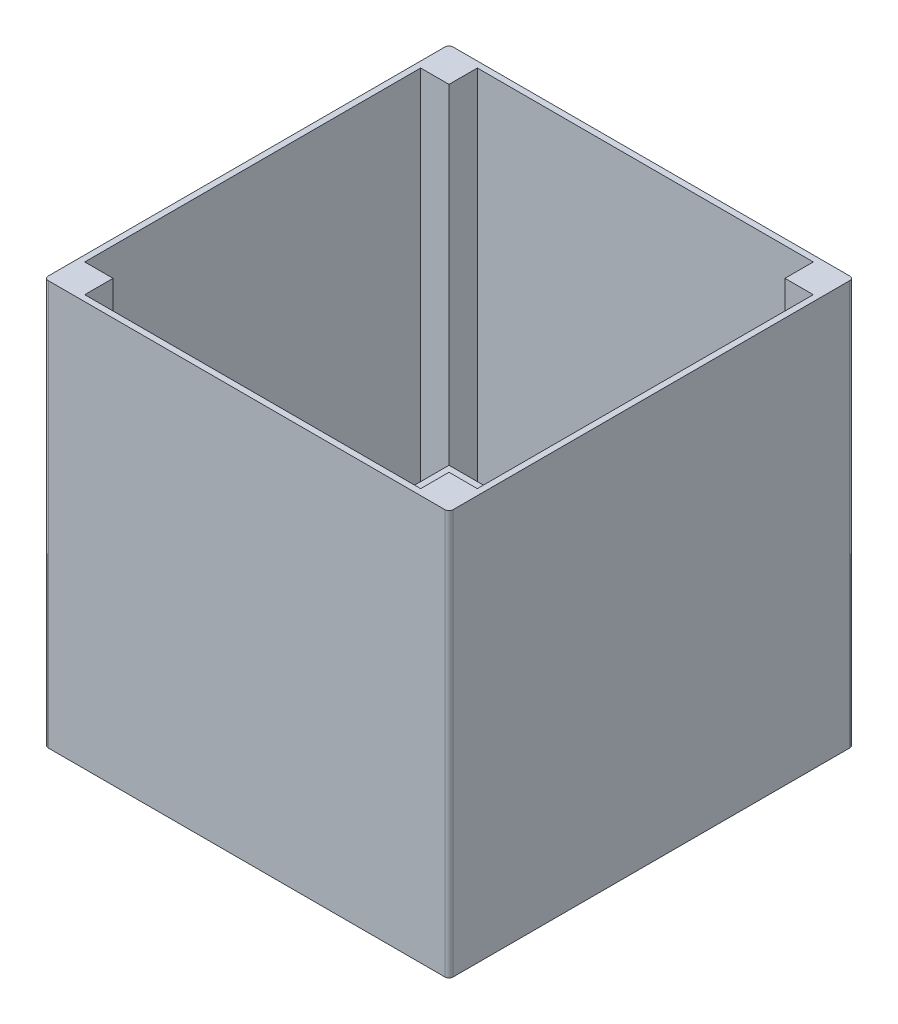
from build123d import *

# Parameters (mm, degrees)
SKETCH1_W           = 100
SKETCH1_H           = 100
BOSS_EXTRUDE2_DEPTH = 100
SKETCH2_W           = 80
SKETCH2_H           = 80
SKETCH2_R           = 1.6
BOSS_EXTRUDE3_DEPTH = 2
FILLET1_R           = 1


with BuildPart() as part:
    # Sketch1 → Boss-Extrude2 (new body)
    with BuildSketch(Plane(origin=(0, 0, 0), x_dir=(1, 0, 0), z_dir=(0, 1, 0))):
        Rectangle(SKETCH1_W, SKETCH1_H)
        Polygon((41.5, -48.5), (-41.5, -48.5), (-41.5, -41.5), (-48.5, -41.5), (-48.5, 41.5), (-41.5, 41.5), (-41.5, 48.5), (41.5, 48.5), (41.5, 41.5), (48.5, 41.5), (48.5, -41.5), (41.5, -41.5), align=None, mode=Mode.SUBTRACT)
    extrude(amount=BOSS_EXTRUDE2_DEPTH)

    # Fillet1
    fillet1_edges = [part.edges().sort_by_distance(p)[0] for p in [
        (50, 50, -50),
        (50, 50, 50),
        (-50, 50, 50),
        (-50, 50, -50),
    ]]
    fillet(fillet1_edges, radius=FILLET1_R)


with BuildPart() as body_2:
    # Sketch2 → Boss-Extrude3 (new body)
    with BuildSketch(Plane(origin=(0, 20, 0), x_dir=(-1, 0, 0), z_dir=(0, -1, 0))):
        Rectangle(SKETCH2_W, SKETCH2_H)
        with Locations(Location((-35, -35, 0), (0, 0, 90))):
            Circle(SKETCH2_R, mode=Mode.SUBTRACT)
        with Locations(Location((35, 35, 0), (0, 0, 270))):
            Circle(SKETCH2_R, mode=Mode.SUBTRACT)
        with Locations(Location((35, -35, 0), (0, 0, 270))):
            Circle(SKETCH2_R, mode=Mode.SUBTRACT)
        with Locations(Location((-35, 35, 0), (0, 0, 90))):
            Circle(SKETCH2_R, mode=Mode.SUBTRACT)
    extrude(amount=BOSS_EXTRUDE3_DEPTH)


solid = Compound([part.part, body_2.part])
